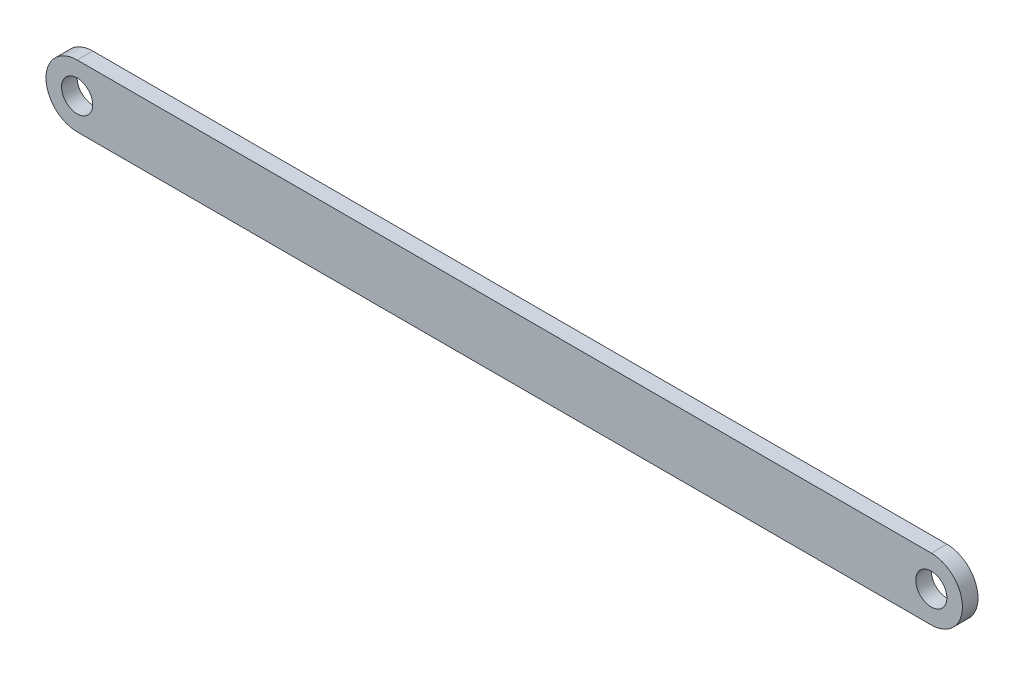
from build123d import *

# Parameters (mm, degrees)
ESBO_O1_R                = 1
RESSALTO_EXTRUS_O1_DEPTH = 1


with BuildPart() as part:
    # Esboço1 → Ressalto-extrusão1 (new body)
    with BuildSketch(Plane.XY):
        with BuildLine():
            Line((-27.435, 2), (27.435, 2))
            ThreePointArc((27.435, 2), (29.435, 0), (27.435, -2))
            Line((27.435, -2), (-27.435, -2))
            ThreePointArc((-27.435, -2), (-29.435, 0), (-27.435, 2))
        make_face()
        with Locations((-27.435, 0)):
            Circle(ESBO_O1_R, mode=Mode.SUBTRACT)
        with Locations((27.435, 0)):
            Circle(ESBO_O1_R, mode=Mode.SUBTRACT)
    extrude(amount=RESSALTO_EXTRUS_O1_DEPTH)


solid = part.part
